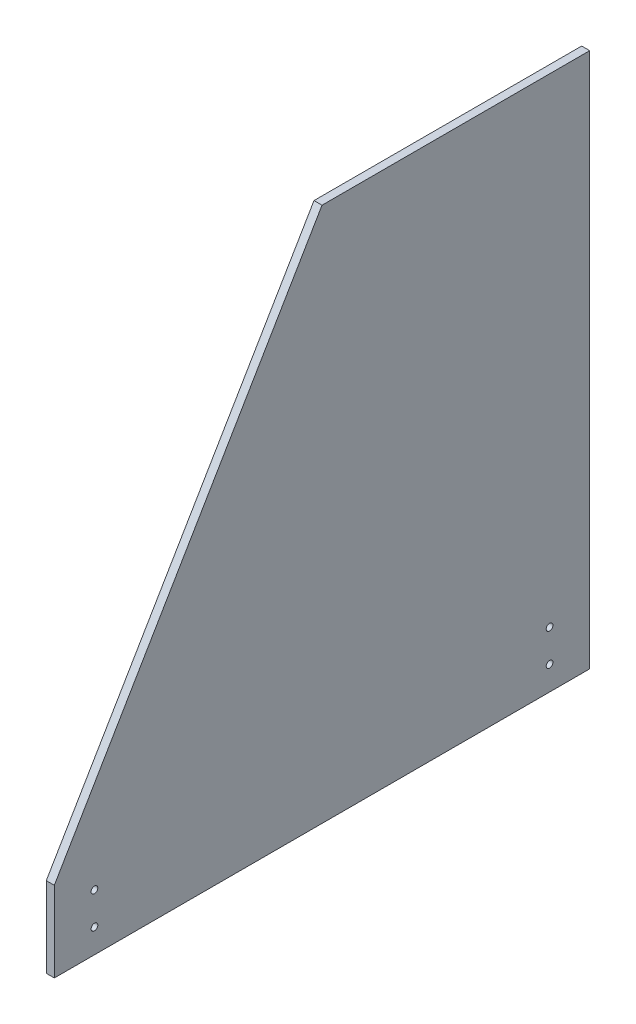
from build123d import *

# Parameters (mm, degrees)
SKETCH1_R           = 2.5
BOSS_EXTRUDE1_DEPTH = 6


with BuildPart() as part:
    # Sketch1 → Boss-Extrude1 (new body)
    with BuildSketch(Plane(origin=(0, 0, 0), x_dir=(0, 0, -1), z_dir=(1, 0, 0))):
        Polygon((0, 0), (400, 0), (400, 400), (200, 400), (0, 60), align=None)
        with Locations((30, 42)):
            Circle(SKETCH1_R, mode=Mode.SUBTRACT)
        with Locations(Location((30, 18, 0), (0, 0, 180))):
            Circle(SKETCH1_R, mode=Mode.SUBTRACT)
        with Locations((370, 18)):
            Circle(SKETCH1_R, mode=Mode.SUBTRACT)
        with Locations(Location((370, 42, 0), (0, 0, 180))):
            Circle(SKETCH1_R, mode=Mode.SUBTRACT)
    extrude(amount=BOSS_EXTRUDE1_DEPTH)


solid = part.part
